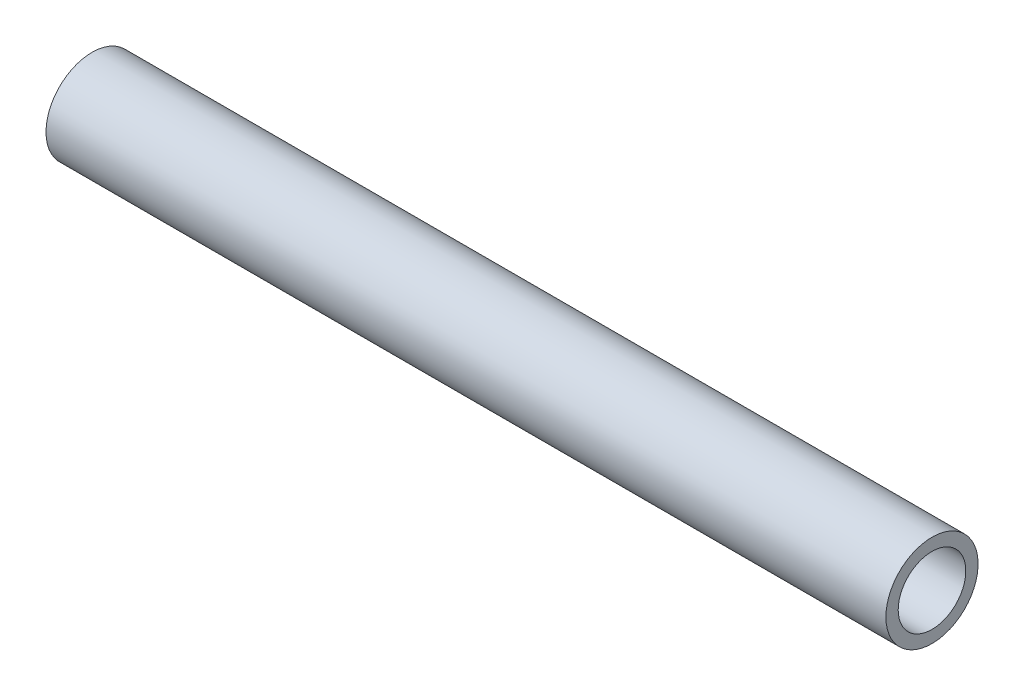
from build123d import *

# Parameters (mm, degrees)
AXIAL_PROFILE_MM_W = 41
AXIAL_PROFILE_MM_H = 0.6


with BuildPart() as part:
    # Axial profile (mm) → Full revolution (revolve)
    with BuildSketch(Plane.XY, mode=Mode.PRIVATE) as full_revolution_sk:
        with Locations((139.2, 1.95)):
            Rectangle(AXIAL_PROFILE_MM_W, AXIAL_PROFILE_MM_H)
    revolve(full_revolution_sk.sketch.rotate(Axis((-110, 0, 0), (1, 0, 0)), 90), axis=Axis((-110, 0, 0), (1, 0, 0)))


solid = part.part
